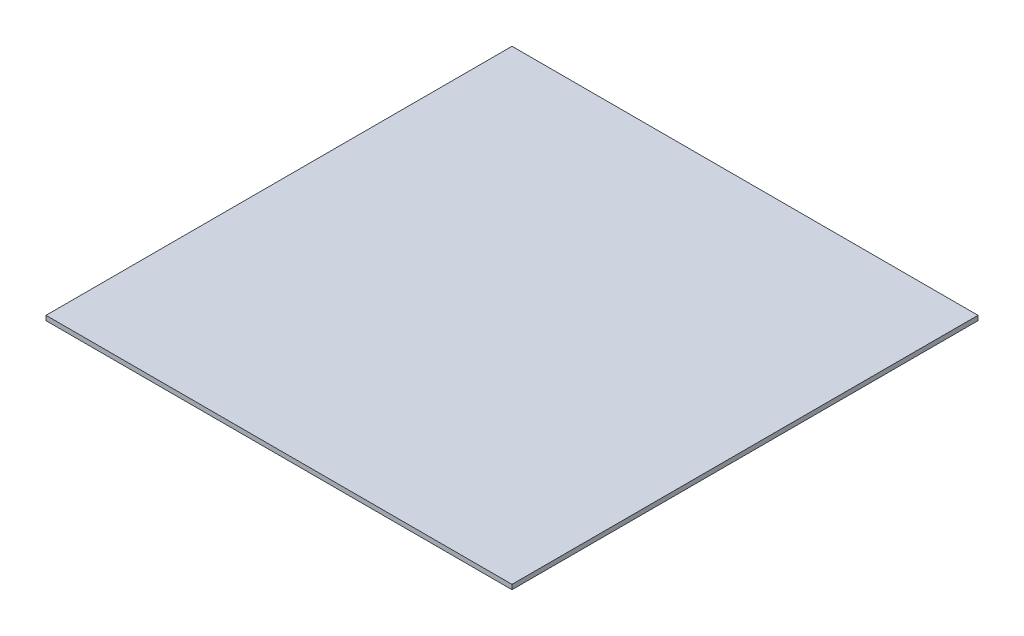
from build123d import *

# Parameters (mm, degrees)
SKETCH1_W           = 300
SKETCH1_H           = 300
BOSS_EXTRUDE1_DEPTH = 3


with BuildPart() as part:
    # Sketch1 → Boss-Extrude1 (new body)
    with BuildSketch(Plane(origin=(0, 0, 0), x_dir=(1, 0, 0), z_dir=(0, 1, 0))):
        Rectangle(SKETCH1_W, SKETCH1_H)
    extrude(amount=BOSS_EXTRUDE1_DEPTH)


solid = part.part
